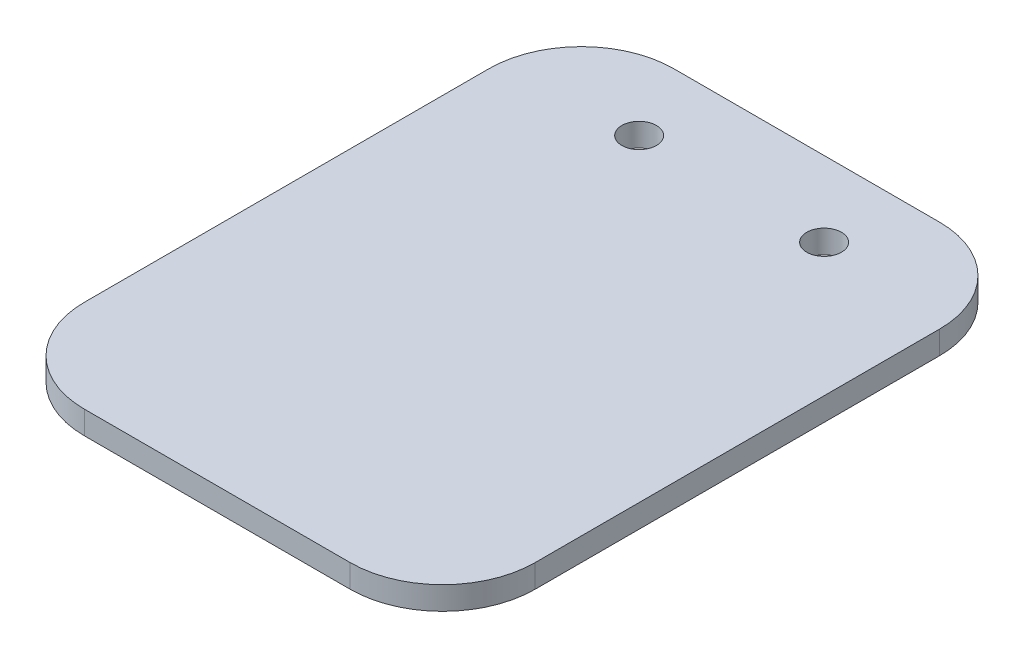
from build123d import *

# Parameters (mm, degrees)
SKETCH1_R           = 1.5
BOSS_EXTRUDE1_DEPTH = 2


with BuildPart() as part:
    # Sketch1 → Boss-Extrude1 (new body)
    with BuildSketch(Plane(origin=(0, 0, 0), x_dir=(1, 0, 0), z_dir=(0, 1, 0))):
        with BuildLine():
            Line((8, 0), (31, 0))
            ThreePointArc((31, 0), (36.656854249, 2.343145751), (39, 8))
            Line((39, 8), (39, 43))
            ThreePointArc((39, 43), (36.656854249, 48.656854249), (31, 51))
            Line((31, 51), (8, 51))
            ThreePointArc((8, 51), (2.343145751, 48.656854249), (0, 43))
            Line((0, 43), (0, 8))
            ThreePointArc((0, 8), (2.343145751, 2.343145751), (8, 0))
        make_face()
        with Locations(Location((27.5, 44.5, 0), (0, 0, 270))):
            Circle(SKETCH1_R, mode=Mode.SUBTRACT)
        with Locations(Location((11.5, 44.5, 0), (0, 0, 90))):
            Circle(SKETCH1_R, mode=Mode.SUBTRACT)
    extrude(amount=BOSS_EXTRUDE1_DEPTH)


solid = part.part
